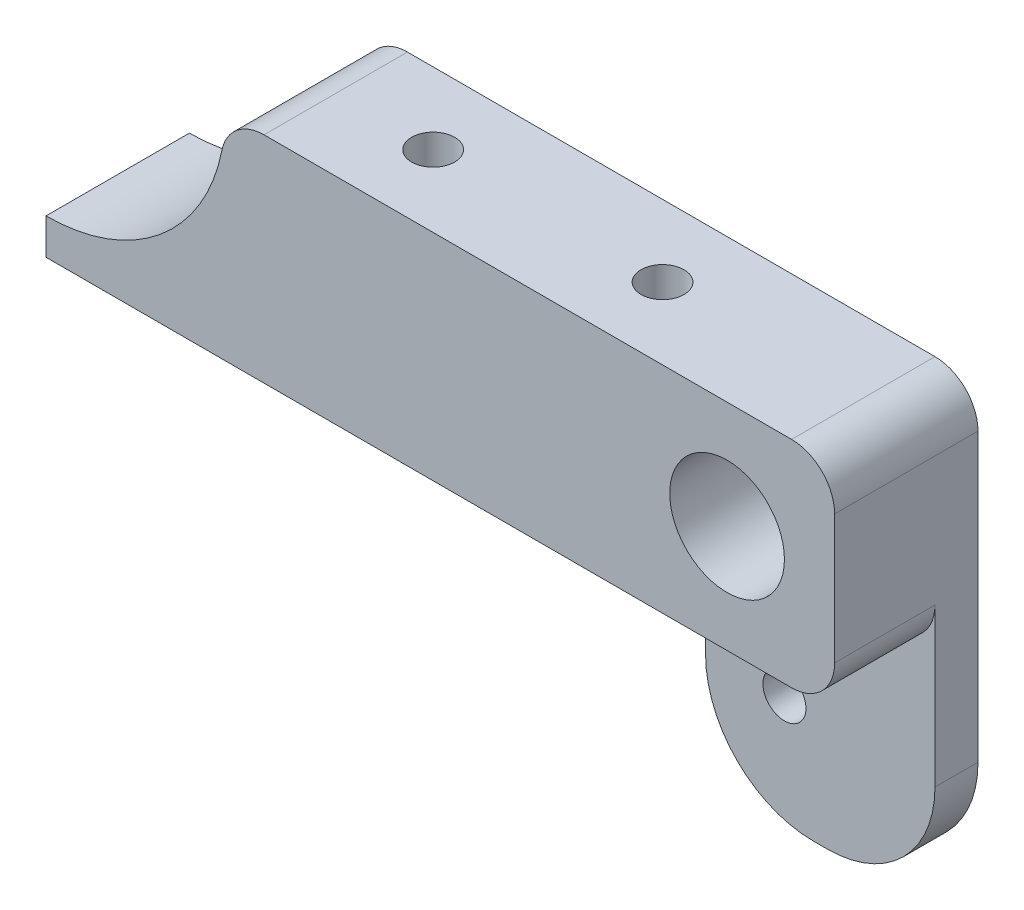
from build123d import *

# Parameters (mm, degrees)
CROQUIS1_R              = 4
SALIENTE_EXTRUIR1_DEPTH = 10
CROQUIS3_W              = 16
CROQUIS3_H              = 15.5
CROQUIS3_R              = 1.5
SALIENTE_EXTRUIR2_DEPTH = 3
REDONDEO1_R             = 7.5
REDONDEO2_R             = 3
CROQUIS4_R              = 1.5
CORTAR_EXTRUIR2_DEPTH   = 15
REDONDEO3_R             = 3


with BuildPart() as part:
    # Croquis1 → Saliente-Extruir1 (new body)
    with BuildSketch(Plane.XY):
        with BuildLine():
            Line((-35, 7.5), (7.5, 7.5))
            Line((7.5, 7.5), (7.5, -7.5))
            Line((7.5, -7.5), (-47.5, -7.5))
            Line((-47.5, -7.5), (-47.5, -5))
            ThreePointArc((-47.5, -5), (-38.661165235, -1.338834765), (-35, 7.5))
        make_face()
        Circle(CROQUIS1_R, mode=Mode.SUBTRACT)
    extrude(amount=SALIENTE_EXTRUIR1_DEPTH)

    # Croquis3 → Saliente-Extruir2 (add)
    with BuildSketch(Plane.XY):
        with Locations((-0.5, -15.25)):
            Rectangle(CROQUIS3_W, CROQUIS3_H)
        with Locations((-3, -15.25)):
            Circle(CROQUIS3_R, mode=Mode.SUBTRACT)
    extrude(amount=SALIENTE_EXTRUIR2_DEPTH)

    # Redondeo1
    redondeo1_edges = [part.edges().sort_by_distance(p)[0] for p in [
        (7.5, -23, 1.5),
        (-8.5, -23, 1.5),
    ]]
    fillet(redondeo1_edges, radius=REDONDEO1_R)

    # Redondeo2
    redondeo2_edges = [part.edges().sort_by_distance(p)[0] for p in [
        (-8.5, -7.5, 1.5),
    ]]
    fillet(redondeo2_edges, radius=REDONDEO2_R)

    # Croquis4 → Cortar-Extruir2 (cut)
    with BuildSketch(Plane(origin=(0, 7.5, 0), x_dir=(1, 0, 0), z_dir=(0, 1, 0))):
        with Locations(Location((-25.5, -5, 0), (0, 0, 270))):
            Circle(CROQUIS4_R)
        with Locations(Location((-9.5, -5, 0), (0, 0, 270))):
            Circle(CROQUIS4_R)
    extrude(amount=-CORTAR_EXTRUIR2_DEPTH, mode=Mode.SUBTRACT)

    # Redondeo3
    redondeo3_edges = [part.edges().sort_by_distance(p)[0] for p in [
        (7.5, -7.5, 6.5),
        (-35, 7.5, 5),
        (7.5, 7.5, 5),
    ]]
    fillet(redondeo3_edges, radius=REDONDEO3_R)


solid = part.part
